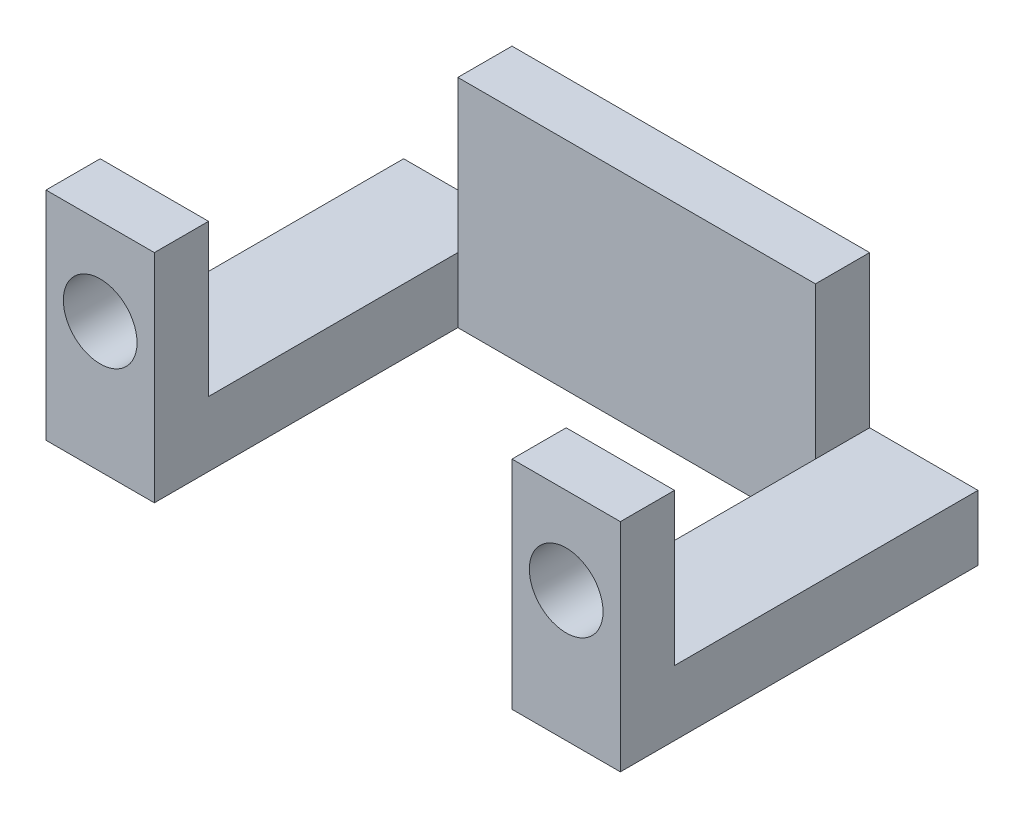
from build123d import *

# Parameters (mm, degrees)
BOSS_EXTRUDE1_DEPTH = 5
SKETCH1_7_W         = 10
SKETCH1_7_H         = 6
BOSS_EXTRUDE2_DEPTH = 33
BOSS_EXTRUDE3_START = 33
SKETCH1_9_W         = 10
SKETCH1_9_H         = 14
SKETCH1_9_R         = 3.4
BOSS_EXTRUDE3_DEPTH = 5


with BuildPart() as part:
    # Sketch1 → Boss-Extrude1 (new body)
    with BuildSketch(Plane.XY):
        Polygon((-628.74225666, -346.426096697), (-661.74225666, -346.426096697), (-661.74225666, -360.426096697), (-661.74225666, -366.426096697), (-628.74225666, -366.426096697), (-628.74225666, -360.426096697), align=None)
    extrude(amount=BOSS_EXTRUDE1_DEPTH)

    # Sketch1<7> → Boss-Extrude2 (add)
    with BuildSketch(Plane.XY):
        with Locations((-666.74225666, -363.426096697)):
            Rectangle(SKETCH1_7_W, SKETCH1_7_H)
        with Locations((-623.74225666, -363.426096697)):
            Rectangle(SKETCH1_7_W, SKETCH1_7_H)
    extrude(amount=BOSS_EXTRUDE2_DEPTH)

    # Sketch1<9> → Boss-Extrude3 (add)
    # profile 1 of 2: a face of its own
    with BuildSketch(Plane.XY.offset(BOSS_EXTRUDE3_START)):
        with Locations((-666.74225666, -353.426096697)):
            Rectangle(SKETCH1_9_W, SKETCH1_9_H)
        with Locations((-666.74225666, -354.426096697)):
            Circle(SKETCH1_9_R, mode=Mode.SUBTRACT)
    # profile 2 of 2: a face of its own
    with BuildSketch(Plane.XY.offset(BOSS_EXTRUDE3_START)):
        with Locations((-623.74225666, -353.426096697)):
            Rectangle(SKETCH1_9_W, SKETCH1_9_H)
        with Locations((-623.74225666, -354.426096697)):
            Circle(SKETCH1_9_R, mode=Mode.SUBTRACT)
    extrude(amount=-BOSS_EXTRUDE3_DEPTH)


solid = part.part
